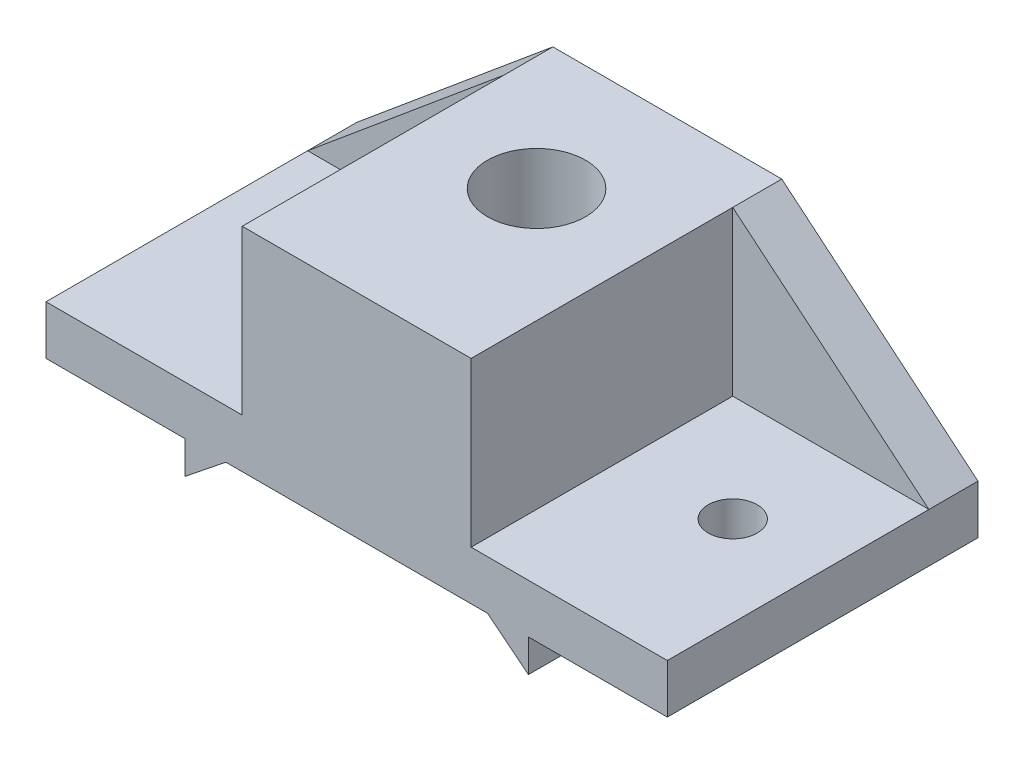
from build123d import *

# Parameters (mm, degrees)
BOSS_EXTRUDE2_DEPTH = 38
BOSS_EXTRUDE3_DEPTH = 6
SKETCH6_R           = 6
SKETCH6_R_2         = 3
CUT_EXTRUDE1_DEPTH  = 91.111042609


with BuildPart() as part:
    # Sketch1 → Boss-Extrude2 (new body)
    with BuildSketch(Plane.XY):
        Polygon((52, 26), (24, 26), (24, 6), (0, 6), (0, 0), (17, 0), (17, -4), (22, 0), (54, 0), (59, -4), (59, 0), (76, 0), (76, 6), (52, 6), align=None)
    extrude(amount=BOSS_EXTRUDE2_DEPTH)

    # Sketch1<4> → Boss-Extrude3 (add)
    with BuildSketch(Plane.XY):
        Polygon((24, 6), (24, 26), (0, 6), align=None)
        Polygon((76, 6), (52, 26), (52, 6), align=None)
    extrude(amount=BOSS_EXTRUDE3_DEPTH)

    # Sketch6 → Cut-Extrude1 (cut, through all)
    with BuildSketch(Plane(origin=(0, 26, 0), x_dir=(1, 0, 0), z_dir=(0, 1, 0))):
        with Locations((38, -16)):
            Circle(SKETCH6_R)
        with Locations((65, -19)):
            Circle(SKETCH6_R_2)
        with Locations((11, -19)):
            Circle(SKETCH6_R_2)
    extrude(amount=-CUT_EXTRUDE1_DEPTH, mode=Mode.SUBTRACT)


solid = part.part
